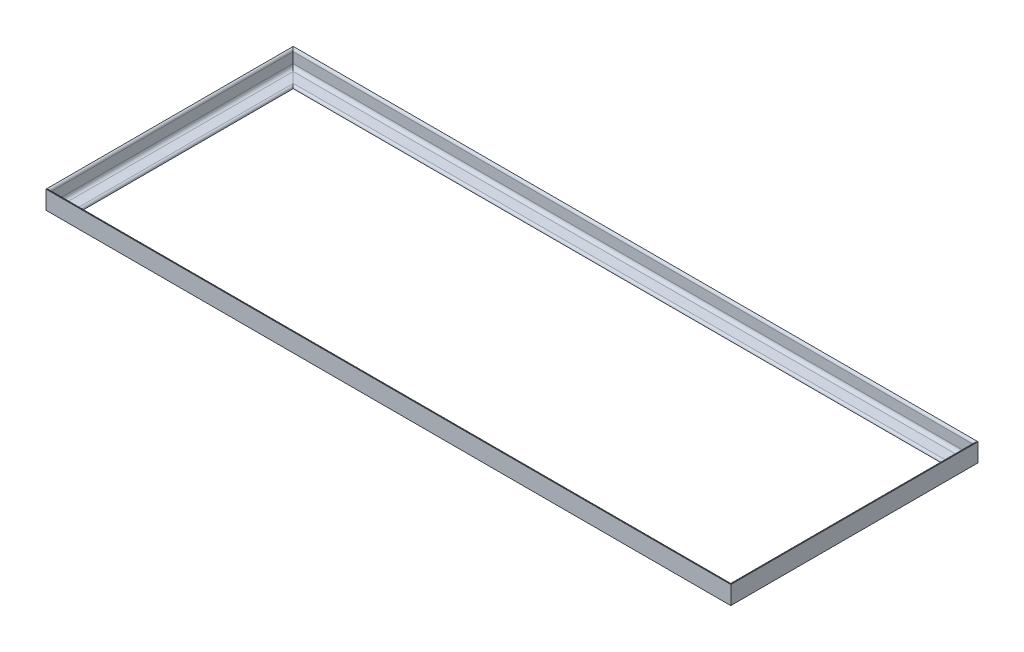
from build123d import *

# Parameters (mm, degrees)
HIERRO_ANGULAR_1_X_1_X_0_125_1_DEPTH      = 379.921024484
HIERRO_ANGULAR_1_X_1_X_0_125_1_DEPTH_BACK = 36.921024484
HIERRO_ANGULAR_1_X_1_X_0_125_1_2_DEPTH    = 1023.842048969
HIERRO_ANGULAR_1_X_1_X_0_125_1_3_DEPTH    = 416.842048969
HIERRO_ANGULAR_1_X_1_X_0_125_1_4_DEPTH    = 1023.842048969


with BuildPart() as part:
    # Sketch1 → Hierro angular 1 X 1 X 0.125(1) (new, two sides: drawn at the far end of the back side and taken through both)
    with BuildSketch(Plane(origin=(-475, 0, -171.5), x_dir=(1, 0, 0), z_dir=(0, 0, 1)).offset(-HIERRO_ANGULAR_1_X_1_X_0_125_1_DEPTH_BACK)):
        with BuildLine():
            Line((0, 0), (0, 25.4))
            Line((0, 25.4), (0.00508, 25.4))
            ThreePointArc((0.00508, 25.4), (2.246551928, 24.471551928), (3.175, 22.23008))
            Line((3.175, 22.23008), (3.175, 7.9375))
            ThreePointArc((3.175, 7.9375), (4.569903955, 4.569903955), (7.9375, 3.175))
            Line((7.9375, 3.175), (22.23008, 3.175))
            ThreePointArc((22.23008, 3.175), (24.471551928, 2.246551928), (25.4, 0.00508))
            Line((25.4, 0.00508), (25.4, 0))
            Line((25.4, 0), (0, 0))
        make_face()
    extrude(amount=HIERRO_ANGULAR_1_X_1_X_0_125_1_DEPTH + HIERRO_ANGULAR_1_X_1_X_0_125_1_DEPTH_BACK)

    # Hierro angular 1 X 1 X 0.125(1) mitre 1
    split(bisect_by=Plane(origin=(-475, 0, -171.5), x_dir=(0, -1, 0), z_dir=(-0.707106781, 0, 0.707106781)), keep=Keep.TOP)

    # Hierro angular 1 X 1 X 0.125(1) mitre 2
    split(bisect_by=Plane(origin=(-475, 0, 171.5), x_dir=(0, -1, 0), z_dir=(-0.707106781, 0, -0.707106781)), keep=Keep.TOP)


with BuildPart() as body_2:
    # Sketch1 on segment 2 (carried to segment 2) → Hierro angular 1 X 1 X 0.125_1 2 (new body)
    with BuildSketch(Plane(origin=(-511.921024484, 0, 171.5), x_dir=(0, 0, -1), z_dir=(1, 0, 0))):
        with BuildLine():
            Line((0, 0), (0, 25.4))
            Line((0, 25.4), (0.00508, 25.4))
            ThreePointArc((0.00508, 25.4), (2.246551928, 24.471551928), (3.175, 22.23008))
            Line((3.175, 22.23008), (3.175, 7.9375))
            ThreePointArc((3.175, 7.9375), (4.569903955, 4.569903955), (7.9375, 3.175))
            Line((7.9375, 3.175), (22.23008, 3.175))
            ThreePointArc((22.23008, 3.175), (24.471551928, 2.246551928), (25.4, 0.00508))
            Line((25.4, 0.00508), (25.4, 0))
            Line((25.4, 0), (0, 0))
        make_face()
    extrude(amount=HIERRO_ANGULAR_1_X_1_X_0_125_1_2_DEPTH)

    # Hierro angular 1 X 1 X 0.125_1 2 mitre 1
    split(bisect_by=Plane(origin=(-475, 0, 171.5), x_dir=(0, 1, 0), z_dir=(0.707106781, 0, 0.707106781)), keep=Keep.TOP)

    # Hierro angular 1 X 1 X 0.125_1 2 mitre 2
    split(bisect_by=Plane(origin=(475, 0, 171.5), x_dir=(0, -1, 0), z_dir=(-0.707106781, 0, 0.707106781)), keep=Keep.TOP)


with BuildPart() as body_3:
    # Sketch1 on segment 3 (carried to segment 3) → Hierro angular 1 X 1 X 0.125_1 3 (new body)
    with BuildSketch(Plane(origin=(475, 0, 208.421024484), x_dir=(-1, 0, 0), z_dir=(0, 0, -1))):
        with BuildLine():
            Line((0, 0), (0, 25.4))
            Line((0, 25.4), (0.00508, 25.4))
            ThreePointArc((0.00508, 25.4), (2.246551928, 24.471551928), (3.175, 22.23008))
            Line((3.175, 22.23008), (3.175, 7.9375))
            ThreePointArc((3.175, 7.9375), (4.569903955, 4.569903955), (7.9375, 3.175))
            Line((7.9375, 3.175), (22.23008, 3.175))
            ThreePointArc((22.23008, 3.175), (24.471551928, 2.246551928), (25.4, 0.00508))
            Line((25.4, 0.00508), (25.4, 0))
            Line((25.4, 0), (0, 0))
        make_face()
    extrude(amount=HIERRO_ANGULAR_1_X_1_X_0_125_1_3_DEPTH)

    # Hierro angular 1 X 1 X 0.125_1 3 mitre 1
    split(bisect_by=Plane(origin=(475, 0, -171.5), x_dir=(0, 1, 0), z_dir=(0.707106781, 0, 0.707106781)), keep=Keep.TOP)

    # Hierro angular 1 X 1 X 0.125_1 3 mitre 2
    split(bisect_by=Plane(origin=(475, 0, 171.5), x_dir=(0, 1, 0), z_dir=(0.707106781, 0, -0.707106781)), keep=Keep.TOP)


with BuildPart() as body_4:
    # Sketch1 on segment 4 (carried to segment 4) → Hierro angular 1 X 1 X 0.125_1 4 (new body)
    with BuildSketch(Plane(origin=(511.921024484, 0, -171.5), x_dir=(0, 0, 1), z_dir=(-1, 0, 0))):
        with BuildLine():
            Line((0, 0), (0, 25.4))
            Line((0, 25.4), (0.00508, 25.4))
            ThreePointArc((0.00508, 25.4), (2.246551928, 24.471551928), (3.175, 22.23008))
            Line((3.175, 22.23008), (3.175, 7.9375))
            ThreePointArc((3.175, 7.9375), (4.569903955, 4.569903955), (7.9375, 3.175))
            Line((7.9375, 3.175), (22.23008, 3.175))
            ThreePointArc((22.23008, 3.175), (24.471551928, 2.246551928), (25.4, 0.00508))
            Line((25.4, 0.00508), (25.4, 0))
            Line((25.4, 0), (0, 0))
        make_face()
    extrude(amount=HIERRO_ANGULAR_1_X_1_X_0_125_1_4_DEPTH)

    # Hierro angular 1 X 1 X 0.125_1 4 mitre 1
    split(bisect_by=Plane(origin=(-475, 0, -171.5), x_dir=(0, 1, 0), z_dir=(0.707106781, 0, -0.707106781)), keep=Keep.TOP)

    # Hierro angular 1 X 1 X 0.125_1 4 mitre 2
    split(bisect_by=Plane(origin=(475, 0, -171.5), x_dir=(0, -1, 0), z_dir=(-0.707106781, 0, -0.707106781)), keep=Keep.TOP)


solid = Compound([part.part, body_2.part, body_3.part, body_4.part])
